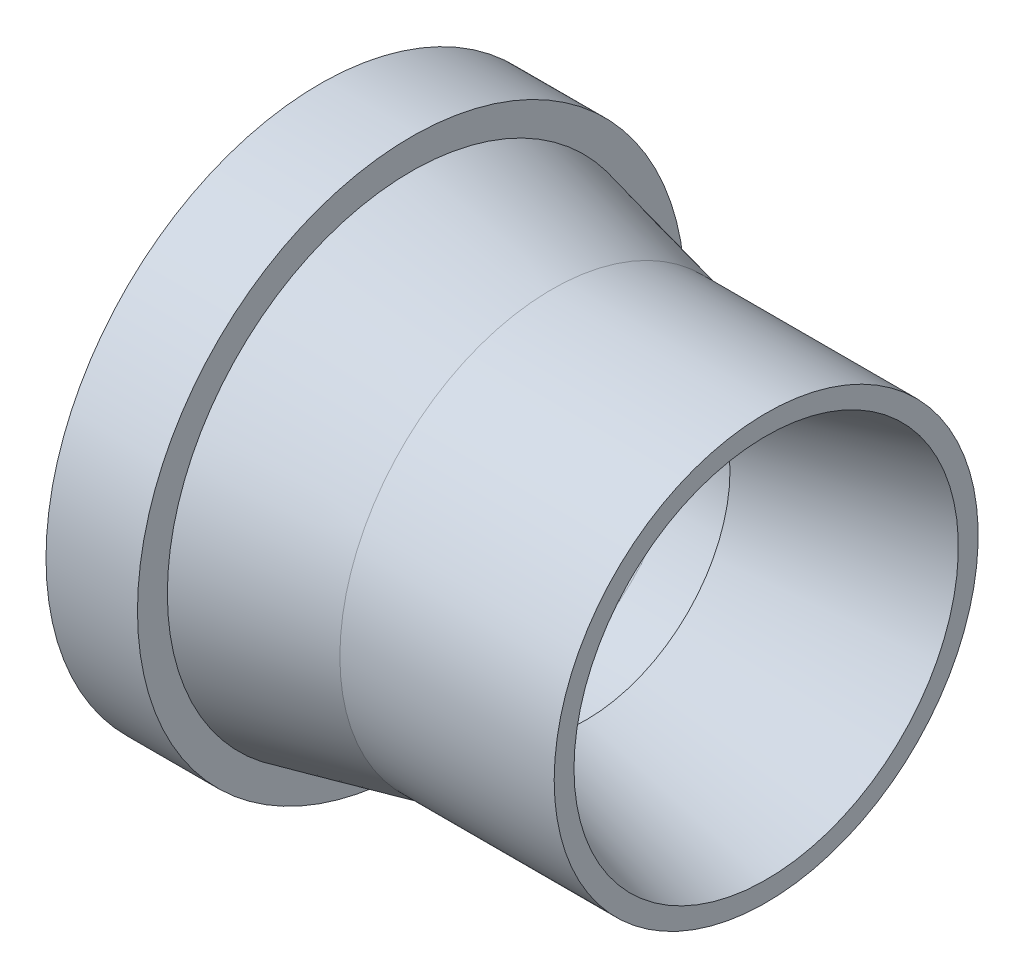
from build123d import *


with BuildPart() as part:
    # Sketch1 → Revolve1 (revolve)
    with BuildSketch(Plane.XY, mode=Mode.PRIVATE) as revolve1_sk:
        Polygon((0, 34.798), (12.058408399, 22.739591601), (16.74635158, 22.739591601), (25.18437156, 20.53500071), (33.843289446, 20.53500071), (33.843289446, 18.292602901), (56.73579947, 24.426632475), (56.73579947, 26.944570435), (29.496610327, 26.944570435), (11.626929507, 31.001470945), (11.626929507, 34.798), align=None)
    revolve(revolve1_sk.sketch.rotate(Axis((0, 0, 0), (1, 0, 0)), 90), axis=Axis((0, 0, 0), (1, 0, 0)))


solid = part.part
